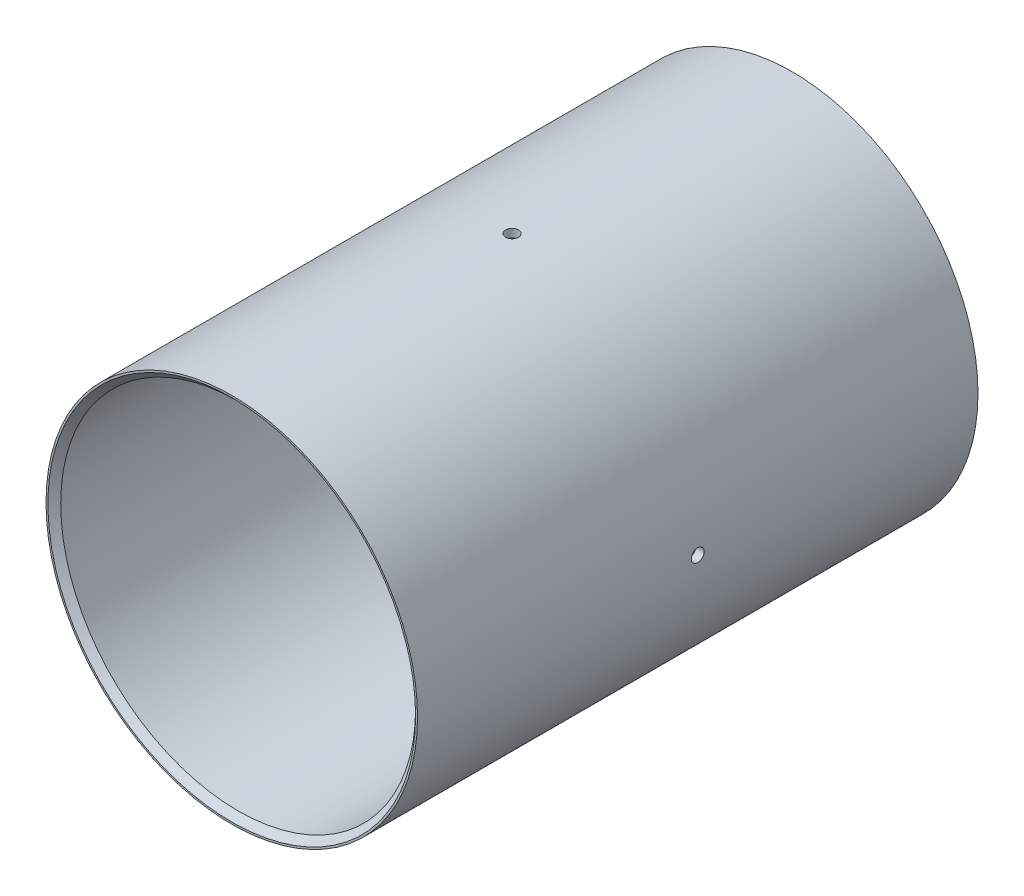
from build123d import *

# Parameters (mm, degrees)
SKETCH1_W         = 1.651
SKETCH1_H         = 111.125
CHAMFER1_SIZE     = 1.27
SKETCH3_R         = 1.27
VENTHOLES_DEPTH   = 91.315461444
CIRPATTERN1_COUNT = 2
CIRPATTERN1_ANGLE = 90


with BuildPart() as part:
    # Sketch1 → Revolve1 (revolve)
    with BuildSketch(Plane(origin=(0, 0, 0), x_dir=(1, 0, 0), z_dir=(0, 1, 0))):
        with Locations((36.0045, 18.220863815)):
            Rectangle(SKETCH1_W, SKETCH1_H)
    revolve(axis=Axis((0, 0, 37.341636185), (0, 0, -1)))

    # Chamfer1
    chamfer1_edges = [part.edges().sort_by_distance(p)[0] for p in [
        (-35.179, 0, 37.341636185),
        (-35.179, 0, -73.783363815),
    ]]
    chamfer(chamfer1_edges, length=CHAMFER1_SIZE)

    # Sketch3 → ventholes (cut, symmetric)
    with BuildSketch(Plane(origin=(0, 0, 0), x_dir=(1, 0, 0), z_dir=(0, 1, 0))):
        with Locations(Location((0, 18.220863815, 0), (0, 0, 270))):
            Circle(SKETCH3_R)
    ventholes = extrude(amount=VENTHOLES_DEPTH, both=True, mode=Mode.SUBTRACT)

    # CirPattern1: ventholes ×2 about axis
    cirpattern1_axis = Axis((0, 0, 37.341636185), (0, 0, 1))
    for i in range(1, CIRPATTERN1_COUNT):
        add(ventholes.rotate(cirpattern1_axis, i * CIRPATTERN1_ANGLE / (CIRPATTERN1_COUNT - 1)), mode=Mode.SUBTRACT)


solid = part.part
